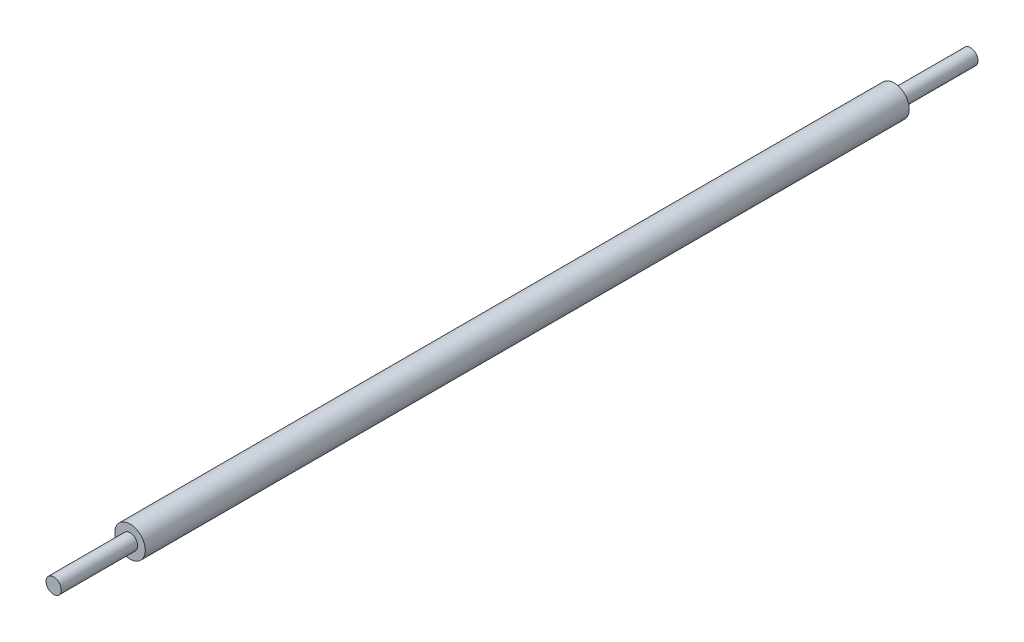
from build123d import *

# Parameters (mm, degrees)
CROQUIS1_R              = 0.05
SALIENTE_EXTRUIR1_DEPTH = 2.5
CROQUIS2_R              = 0.025
SALIENTE_EXTRUIR3_DEPTH = 0.25
SALIENTE_EXTRUIR4_START = 0.25
CROQUIS3_R              = 0.025
SALIENTE_EXTRUIR4_DEPTH = 0.25


with BuildPart() as part:
    # Croquis1 → Saliente-Extruir1 (new body)
    with BuildSketch(Plane.XY):
        Circle(CROQUIS1_R)
    extrude(amount=SALIENTE_EXTRUIR1_DEPTH)

    # Croquis2 → Saliente-Extruir3 (add)
    with BuildSketch(Plane.XY.offset(2.5)):
        Circle(CROQUIS2_R)
    extrude(amount=SALIENTE_EXTRUIR3_DEPTH)

    # Croquis3 → Saliente-Extruir4 (add)
    with BuildSketch(Plane(origin=(0, 0, 0), x_dir=(-1, 0, 0), z_dir=(0, 0, -1)).offset(SALIENTE_EXTRUIR4_START)):
        with Locations(Location((0, 0, 0), (0, 0, 180))):
            Circle(CROQUIS3_R)
    extrude(amount=-SALIENTE_EXTRUIR4_DEPTH)


solid = part.part
